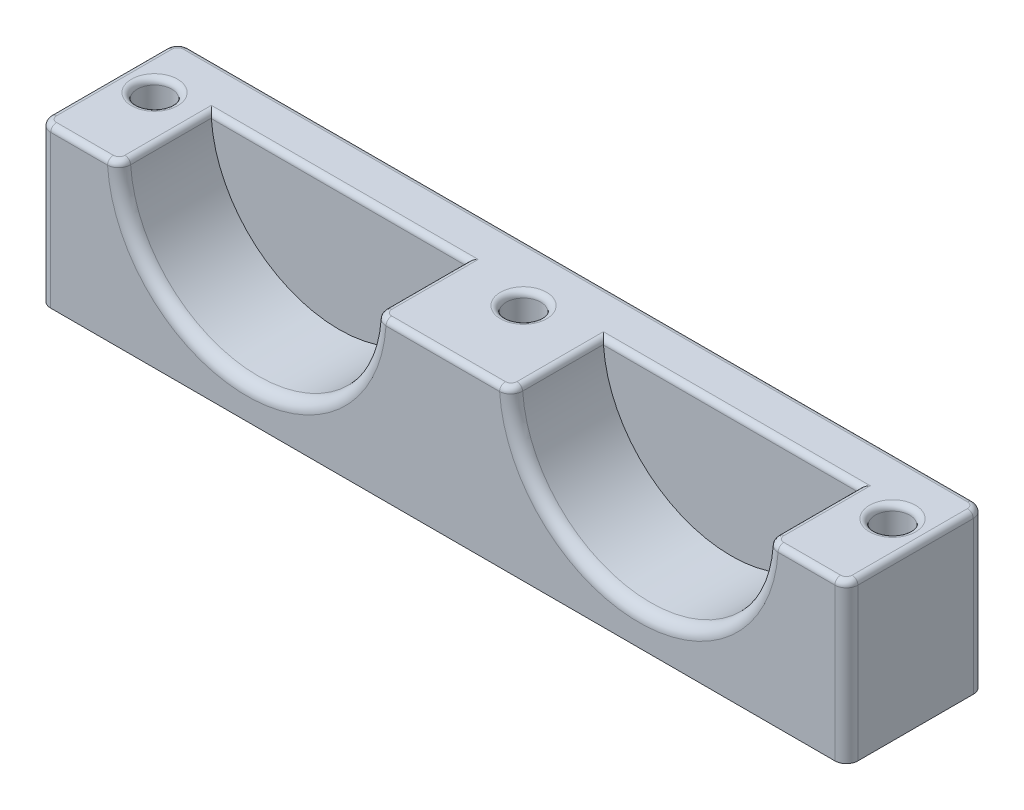
from build123d import *

# Parameters (mm, degrees)
SKETCH1_W           = 70
SKETCH1_H           = 14
BOSS_EXTRUDE1_DEPTH = 12
CUT_EXTRUDE1_DEPTH  = 8
SKETCH3_R           = 1.5
CUT_EXTRUDE2_DEPTH  = 40.56008089
SKETCH4_W           = 12
SKETCH4_H           = 0.3
CUT_EXTRUDE3_DEPTH  = 72.365257654
FILLET1_R           = 1
FILLET2_R           = 0.5


with BuildPart() as part:
    # Sketch1 → Boss-Extrude1 (new body)
    with BuildSketch(Plane.XY):
        Rectangle(SKETCH1_W, SKETCH1_H)
    extrude(amount=BOSS_EXTRUDE1_DEPTH)

    # Sketch2 → Cut-Extrude1 (cut)
    with BuildSketch(Plane.XY.offset(12)):
        with BuildLine():
            Line((5.9, 7), (28.1, 7))
            ThreePointArc((28.1, 7), (17, 18.1), (5.9, 7))
        make_face()
        with BuildLine():
            ThreePointArc((5.9, 7), (17, -4.1), (28.1, 7))
            Line((28.1, 7), (5.9, 7))
        make_face()
    cut_extrude1 = extrude(amount=-CUT_EXTRUDE1_DEPTH, mode=Mode.SUBTRACT)

    # Mirror1: Cut-Extrude1 across plane
    add(cut_extrude1.mirror(Plane(origin=(0, 0, 0), x_dir=(0, 0, 1), z_dir=(1, 0, 0))), mode=Mode.SUBTRACT)

    # Sketch3 → Cut-Extrude2 (cut, through all)
    with BuildSketch(Plane(origin=(0, 7, 0), x_dir=(1, 0, 0), z_dir=(0, 1, 0))):
        with Locations(Location((-32, -5, 0), (0, 0, 180))):
            Circle(SKETCH3_R)
        with Locations(Location((0, -5, 0), (0, 0, 180))):
            Circle(SKETCH3_R)
        with Locations(Location((32, -5, 0), (0, 0, 180))):
            Circle(SKETCH3_R)
    extrude(amount=-CUT_EXTRUDE2_DEPTH, mode=Mode.SUBTRACT)

    # Sketch4 → Cut-Extrude3 (cut, through all)
    with BuildSketch(Plane.ZY.offset(35)):
        with Locations((6, 6.85)):
            Rectangle(SKETCH4_W, SKETCH4_H)
    extrude(amount=-CUT_EXTRUDE3_DEPTH, mode=Mode.SUBTRACT)

    # Fillet1
    fillet1_edges = [part.edges().sort_by_distance(p)[0] for p in [
        (35, -0.15, 12),
        (-17, -4.1, 12),
        (35, -0.15, 0),
        (17, -4.1, 12),
        (-35, -0.15, 0),
        (-35, -0.15, 12),
    ]]
    fillet(fillet1_edges, radius=FILLET1_R)

    # Fillet2
    fillet2_edges = [part.edges().sort_by_distance(p)[0] for p in [
        (-30.5, 6.7, 5),
        (33.5, 6.7, 5),
        (1.5, 6.7, 5),
        (5.904054795, 6.7, 7.5),
        (-17, 6.7, 4),
        (-5.904054795, 6.7, 7.5),
        (17, 6.7, 4),
        (35, 6.7, 6),
        (31.54814021, 6.7, 12),
        (0, 6.7, 0),
        (-35, 6.7, 6),
        (-31.54814021, 6.7, 12),
        (-28.095945205, 6.7, 7.5),
        (0, 6.7, 12),
        (28.095945205, 6.7, 7.5),
        (-34.707106781, 6.7, 11.707106781),
        (-34.707106781, 6.7, 0.292893219),
        (-5.611001162, 6.7, 11.707162854),
        (-28.389554556, 6.7, 11.707717855),
        (5.611001162, 6.7, 11.707162854),
        (28.389554556, 6.7, 11.707717855),
        (34.707106781, 6.7, 11.707106781),
        (34.707106781, 6.7, 0.292893219),
    ]]
    fillet(fillet2_edges, radius=FILLET2_R)


solid = part.part
